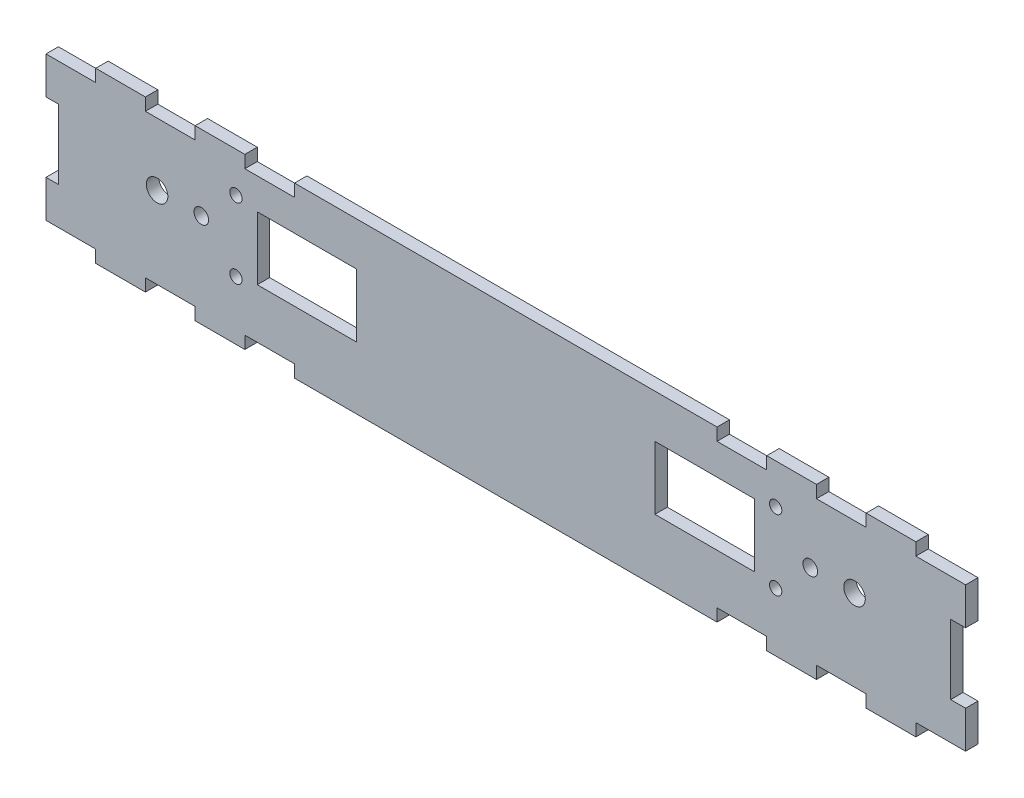
from build123d import *

# Parameters (mm, degrees)
SKETCH3_W           = 234.95
SKETCH3_H           = 30.48
SKETCH3_R           = 1.574999898
SKETCH3_W_2         = 25.4
SKETCH3_H_2         = 3.175
BOSS_EXTRUDE1_DEPTH = 3.175
SKETCH4_W           = 107.95
SKETCH4_H           = 3.175
SKETCH4_W_2         = 12.7
BOSS_EXTRUDE2_DEPTH = 3.175
SKETCH5_W           = 3.175
SKETCH5_H           = 17.78
SKETCH5_W_2         = 3.81
CUT_EXTRUDE1_DEPTH  = 7.62


with BuildPart() as part:
    # Sketch3 → Boss-Extrude1 (new body)
    # profile 1 of 7: a face of its own
    with BuildSketch(Plane.XY):
        with Locations((-63.5, 8.8475)):
            Rectangle(SKETCH3_W, SKETCH3_H)
        with BuildLine():
            ThreePointArc((-163.6, 17.5), (-162.135533906, 21.035533906), (-158.6, 22.5))
            Line((-158.6, 22.5), (-127, 22.5))
            Line((-127, 22.5), (-101.6, 22.5))
            Line((-101.6, 22.5), (-101.6, 19.325))
            Line((-101.6, 19.325), (-101.6, 3.175))
            Line((-101.6, 3.175), (-101.6, 0))
            Line((-101.6, 0), (-127, 0))
            Line((-127, 0), (-158.6, 0))
            ThreePointArc((-158.6, 0), (-162.135533906, 1.464466094), (-163.6, 5))
            Line((-163.6, 5), (-163.6, 17.5))
        make_face(mode=Mode.SUBTRACT)
        with BuildLine():
            Line((-25.4, 22.5), (0, 22.5))
            Line((0, 22.5), (31.6, 22.5))
            ThreePointArc((31.6, 22.5), (35.135533906, 21.035533906), (36.6, 17.5))
            Line((36.6, 17.5), (36.6, 5))
            ThreePointArc((36.6, 5), (35.135533906, 1.464466094), (31.6, 0))
            Line((31.6, 0), (0, 0))
            Line((0, 0), (-25.4, 0))
            Line((-25.4, 0), (-25.4, 3.175))
            Line((-25.4, 3.175), (-25.4, 19.325))
            Line((-25.4, 19.325), (-25.4, 22.5))
        make_face(mode=Mode.SUBTRACT)
    # profile 2 of 7: a face of its own
    with BuildSketch(Plane.XY):
        with BuildLine():
            ThreePointArc((-158.6, 0), (-162.135533906, 1.464466094), (-163.6, 5))
            Line((-163.6, 5), (-163.6, 17.5))
            ThreePointArc((-163.6, 17.5), (-162.135533906, 21.035533906), (-158.6, 22.5))
            Line((-158.6, 22.5), (-127, 22.5))
            Line((-127, 22.5), (-127, 0))
            Line((-127, 0), (-158.6, 0))
        make_face()
        with Locations((-132.45, 20.25)):
            Circle(SKETCH3_R, mode=Mode.SUBTRACT)
        with Locations((-132.45, 2.250000072)):
            Circle(SKETCH3_R, mode=Mode.SUBTRACT)
        with BuildLine():
            ThreePointArc((-143.175, 11.25), (-141.3, 13.125), (-139.425, 11.25))
            ThreePointArc((-139.425, 11.25), (-141.3, 9.375), (-143.175, 11.25))
        make_face(mode=Mode.SUBTRACT)
        with BuildLine():
            ThreePointArc((-155.35, 11.25), (-152.6, 14), (-149.85, 11.25))
            ThreePointArc((-149.85, 11.25), (-152.6, 8.5), (-155.35, 11.25))
        make_face(mode=Mode.SUBTRACT)
    # profile 3 of 7: a face of its own
    with BuildSketch(Plane.XY):
        with BuildLine():
            Line((36.6, 5), (36.6, 17.5))
            ThreePointArc((36.6, 17.5), (35.135533906, 21.035533906), (31.6, 22.5))
            Line((31.6, 22.5), (0, 22.5))
            Line((0, 22.5), (0, 0))
            Line((0, 0), (31.6, 0))
            ThreePointArc((31.6, 0), (35.135533906, 1.464466094), (36.6, 5))
        make_face()
        with Locations((5.45, 2.250000072)):
            Circle(SKETCH3_R, mode=Mode.SUBTRACT)
        with Locations((5.45, 20.25)):
            Circle(SKETCH3_R, mode=Mode.SUBTRACT)
        with BuildLine():
            ThreePointArc((16.175, 11.25), (14.3, 13.125), (12.425, 11.25))
            ThreePointArc((12.425, 11.25), (14.3, 9.375), (16.175, 11.25))
        make_face(mode=Mode.SUBTRACT)
        with BuildLine():
            ThreePointArc((28.35, 11.25), (25.6, 14), (22.85, 11.25))
            ThreePointArc((22.85, 11.25), (25.6, 8.5), (28.35, 11.25))
        make_face(mode=Mode.SUBTRACT)
    # profile 4 of 7: a face of its own
    with BuildSketch(Plane.XY):
        with Locations((-12.7, 1.5875)):
            Rectangle(SKETCH3_W_2, SKETCH3_H_2)
    # profile 5 of 7: a face of its own
    with BuildSketch(Plane.XY):
        with Locations((-12.7, 20.9125)):
            Rectangle(SKETCH3_W_2, SKETCH3_H_2)
    # profile 6 of 7: a face of its own
    with BuildSketch(Plane.XY):
        with Locations((-114.3, 20.9125)):
            Rectangle(SKETCH3_W_2, SKETCH3_H_2)
    # profile 7 of 7: a face of its own
    with BuildSketch(Plane.XY):
        with Locations((-114.3, 1.5875)):
            Rectangle(SKETCH3_W_2, SKETCH3_H_2)
    extrude(amount=BOSS_EXTRUDE1_DEPTH)

    # Sketch4 → Boss-Extrude2 (add)
    with BuildSketch(Plane.XY.offset(3.175)):
        with Locations((-63.5, 28.85)):
            Rectangle(SKETCH4_W, SKETCH4_H)
        with Locations((-136.525, 28.85)):
            Rectangle(SKETCH4_W_2, SKETCH4_H)
        with Locations((-161.925, 28.85)):
            Rectangle(SKETCH4_W_2, SKETCH4_H)
        Polygon((-142.875, 27.2625), (-155.575, 27.2625), (-168.275, 27.2625), (-180.975, 27.2625), (-180.975, 24.0875), (53.975, 24.0875), (53.975, 27.2625), (41.275, 27.2625), (28.575, 27.2625), (15.875, 27.2625), (3.175, 27.2625), (-9.525, 27.2625), (-117.475, 27.2625), (-130.175, 27.2625), align=None)
        with Locations((9.525, 28.85)):
            Rectangle(SKETCH4_W_2, SKETCH4_H)
        with Locations((34.925, 28.85)):
            Rectangle(SKETCH4_W_2, SKETCH4_H)
        Polygon((53.975, -6.3925), (-180.975, -6.3925), (-180.975, -9.5675), (-168.275, -9.5675), (-155.575, -9.5675), (-142.875, -9.5675), (-130.175, -9.5675), (-117.475, -9.5675), (-9.525, -9.5675), (3.175, -9.5675), (15.875, -9.5675), (28.575, -9.5675), (41.275, -9.5675), (53.975, -9.5675), align=None)
        with Locations((34.925, -11.155)):
            Rectangle(SKETCH4_W_2, SKETCH4_H)
        with Locations((9.525, -11.155)):
            Rectangle(SKETCH4_W_2, SKETCH4_H)
        with Locations((-63.5, -11.155)):
            Rectangle(SKETCH4_W, SKETCH4_H)
        with Locations((-136.525, -11.155)):
            Rectangle(SKETCH4_W_2, SKETCH4_H)
        with Locations((-161.925, -11.155)):
            Rectangle(SKETCH4_W_2, SKETCH4_H)
    extrude(amount=-BOSS_EXTRUDE2_DEPTH)

    # Sketch5 → Cut-Extrude1 (cut)
    with BuildSketch(Plane.XY.offset(3.175)):
        with Locations((-179.3875, 8.8475)):
            Rectangle(SKETCH5_W, SKETCH5_H)
        with Locations((52.07, 8.8475)):
            Rectangle(SKETCH5_W_2, SKETCH5_H)
    extrude(amount=-CUT_EXTRUDE1_DEPTH, mode=Mode.SUBTRACT)


solid = part.part
